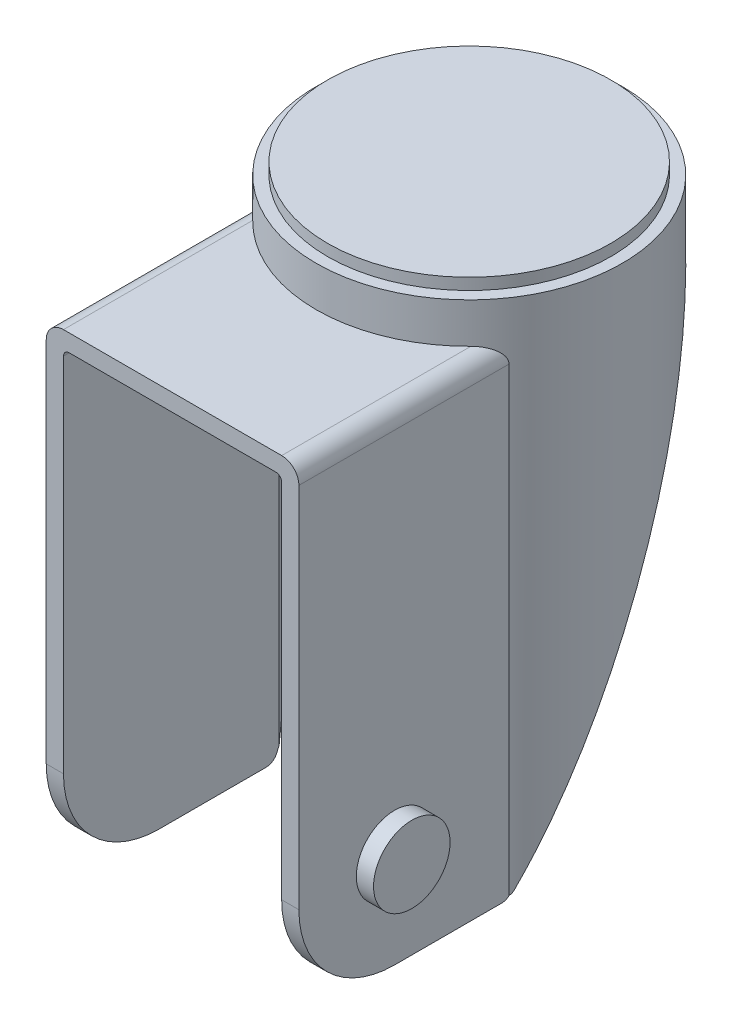
from build123d import *

# Parameters (mm, degrees)
EXTRUDE_1_DEPTH          = 96
CUT_EXTRUDE_1_DEPTH      = 96
SKETCH_4_R               = 23.666666667
CUT_EXTRUDE_2_DEPTH      = 144
CUT_EXTRUDE_3_DEPTH      = 96
CUT_EXTRUDE_3_DEPTH_BACK = 96
SKETCH_7_R               = 9.192307692
CUT_EXTRUDE_4_DEPTH      = 20
SKETCH_8_R               = 6.666666667
EXTRUDE_2_DEPTH          = 3


with BuildPart() as part:
    # 草图1 → 旋转1 (revolve)
    with BuildSketch(Plane.XY, mode=Mode.PRIVATE) as revolve_1_sk:
        Polygon((0, -18), (24.666666667, -18), (24.666666667, -20), (26.666666667, -20), (26.666666667, -162), (0, -162), align=None)
    revolve(revolve_1_sk.sketch.rotate(Axis((0, -162, 0), (0, 1, 0)), 270), axis=Axis((0, -162, 0), (0, 1, 0)))

    # 草图2 → 凸台-拉伸1 (add)
    with BuildSketch(Plane.XY):
        with BuildLine():
            Line((-22, -171), (-19, -171))
            Line((-19, -171), (-19, -31))
            ThreePointArc((-19, -31), (-18.707106781, -30.292893219), (-18, -30))
            Line((-18, -30), (18, -30))
            ThreePointArc((18, -30), (18.707106781, -30.292893219), (19, -31))
            Line((19, -31), (19, -171))
            Line((19, -171), (22, -171))
            Line((22, -171), (22, -30))
            ThreePointArc((22, -30), (21.121320344, -27.878679656), (19, -27))
            Line((19, -27), (-19, -27))
            ThreePointArc((-19, -27), (-21.121320344, -27.878679656), (-22, -30))
            Line((-22, -30), (-22, -171))
        make_face()
    extrude(amount=EXTRUDE_1_DEPTH)

    # 草图3 → 切除-拉伸1 (cut)
    with BuildSketch(Plane.XY):
        with BuildLine():
            Line((-19, -171), (19, -171))
            Line((19, -171), (19, -31))
            ThreePointArc((19, -31), (18.707106781, -30.292893219), (18, -30))
            Line((18, -30), (-18, -30))
            ThreePointArc((-18, -30), (-18.707106781, -30.292893219), (-19, -31))
            Line((-19, -31), (-19, -171))
        make_face()
    extrude(amount=CUT_EXTRUDE_1_DEPTH, mode=Mode.SUBTRACT)

    # 草图4 → 切除-拉伸2 (cut)
    with BuildSketch(Plane(origin=(0, -21, 0), x_dir=(1, 0, 0), z_dir=(0, 1, 0))):
        with Locations(Location((0, 0, 0), (0, 0, 270))):
            Circle(SKETCH_4_R)
    extrude(amount=-CUT_EXTRUDE_2_DEPTH, mode=Mode.SUBTRACT)

    # 草图5 → 切除-拉伸3 (cut, two sides: drawn at the far end of the back side and taken through both)
    with BuildSketch(Plane(origin=(0, 0, 0), x_dir=(0, 0, -1), z_dir=(1, 0, 0)).offset(-CUT_EXTRUDE_3_DEPTH_BACK)):
        with BuildLine():
            Line((-150, -250), (50, -250))
            Line((50, -250), (50, -27))
            Line((50, -27), (25.585063646, -27))
            ThreePointArc((25.585063646, -27), (22.304312848, -27.976388331), (20.091324315, -30.587775267))
            Line((20.091324315, -30.587775267), (-14.545091957, -109.470741578))
            ThreePointArc((-14.545091957, -109.470741578), (-15.282754801, -110.34120389), (-16.3763384, -110.666666667))
            Line((-16.3763384, -110.666666667), (-35, -110.666666667))
            ThreePointArc((-35, -110.666666667), (-46.78511302, -105.78511302), (-51.666666667, -94))
            Line((-51.666666667, -94), (-51.666666667, 0))
            Line((-51.666666667, 0), (-150, 0))
            Line((-150, 0), (-150, -250))
        make_face()
    extrude(amount=CUT_EXTRUDE_3_DEPTH + CUT_EXTRUDE_3_DEPTH_BACK, mode=Mode.SUBTRACT)

    # 草图6 → 旋转2 (revolve)
    with BuildSketch(Plane.XY.offset(35), mode=Mode.PRIVATE) as revolve_2_sk:
        with BuildLine():
            Line((-34, -94), (-34, -90.602564103))
            Line((-34, -90.602564103), (-33.230769231, -89.833333333))
            Line((-33.230769231, -89.833333333), (-30, -89.833333333))
            ThreePointArc((-30, -89.833333333), (-29.556324994, -87.639723002), (-28.5, -85.666666667))
            Line((-28.5, -85.666666667), (-22, -85.666666667))
            Line((-22, -85.666666667), (-22, -94))
            Line((-22, -94), (-34, -94))
        make_face()
    revolve(revolve_2_sk.sketch.rotate(Axis((-22, -94, 35), (-1, 0, 0)), 270), axis=Axis((-22, -94, 35), (-1, 0, 0)))

    # 草图7 → 切除-拉伸4 (cut)
    with BuildSketch(Plane(origin=(-22, 0, 0), x_dir=(0, 0, -1), z_dir=(1, 0, 0))):
        with Locations((-35, -94)):
            Circle(SKETCH_7_R)
        Polygon((-42.142857143, -89.876069506), (-42.142857143, -98.123930494), (-35, -102.247860988), (-27.857142857, -98.123930494), (-27.857142857, -89.876069506), (-35, -85.752139012), align=None, mode=Mode.SUBTRACT)
    extrude(amount=-CUT_EXTRUDE_4_DEPTH, mode=Mode.SUBTRACT)

    # 草图8 → 凸台-拉伸2 (add)
    with BuildSketch(Plane(origin=(22, 0, 0), x_dir=(0, 0, -1), z_dir=(1, 0, 0))):
        with Locations(Location((-35, -94, 0), (0, 0, 180))):
            Circle(SKETCH_8_R)
    extrude(amount=EXTRUDE_2_DEPTH)


solid = part.part
